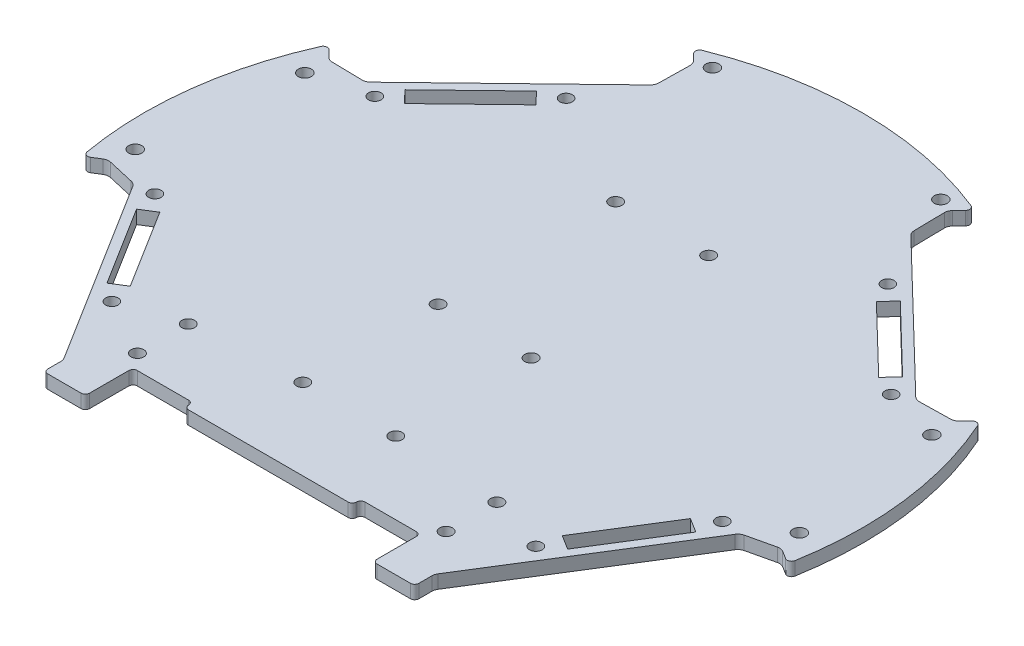
from build123d import *

# Parameters (mm, degrees)
BOSS_EXTRUDE4_DEPTH       = 1.5875
M3_CLEARANCE_HOLE3_D      = 3
M3_CLEARANCE_HOLE1_D      = 3.1
M3_CLEARANCE_HOLE4_D      = 2.95
M3_CLEARANCE_HOLE2_D      = 3.1
M3_CLEARANCE_HOLE5_D      = 3
BOSS_EXTRUDE6_DEPTH       = 3.175
FILLET1_R                 = 2
FILLET3_R                 = 1
ALIGNMENT_CUTOUT_FL_DEPTH = 121.250075508
ALIGNMENT_CUTOUT_FR_DEPTH = 121.250075508
ALIGNMENT_CUTOUT_RL_DEPTH = 121.250075508
ALIGNMENT_CUTOUT_RR_DEPTH = 121.250075508


with BuildPart() as part:
    # Sketch1 → Boss-Extrude4 (new, symmetric)
    with BuildSketch(Plane(origin=(0, 0, 0), x_dir=(1, 0, 0), z_dir=(0, 1, 0))):
        with BuildLine():
            Line((-62.799553621, 32.496136604), (-73.969425011, 32.691107434))
            Line((-73.969425011, 32.691107434), (-77.053684287, 35.88495141))
            ThreePointArc((-77.053684287, 35.88495141), (-84.36642289, 10.358894189), (-83.446216027, -16.178041625))
            Line((-83.446216027, -16.178041625), (-79.680911643, -13.825218315))
            Line((-79.680911643, -13.825218315), (-69.484649137, -16.179210996))
            Line((-69.484649137, -16.179210996), (-43.894490772, -57.132025032))
            Line((-43.894490772, -57.132025032), (-43.894490772, -64.826600275))
            Line((-43.894490772, -64.826600275), (-43.094490772, -64.826600275))
            Line((-43.094490772, -64.826600275), (-34, -64.826600275))
            Line((-34, -64.826600275), (-34, -55.55))
            Line((-34, -55.55), (-34, -53.55))
            Line((-34, -53.55), (-20, -53.55))
            Line((-20, -53.55), (-19.718918331, -55.55))
            Line((-19.718918331, -55.55), (19.718918331, -55.55))
            Line((19.718918331, -55.55), (20, -53.55))
            Line((20, -53.55), (34, -53.55))
            Line((34, -53.55), (34, -55.55))
            Line((34, -55.55), (34, -64.826600275))
            Line((34, -64.826600275), (43.094490772, -64.826600275))
            Line((43.094490772, -64.826600275), (43.894490772, -64.826600275))
            Line((43.894490772, -64.826600275), (43.894490772, -57.132025032))
            Line((43.894490772, -57.132025032), (69.484649137, -16.179210996))
            Line((69.484649137, -16.179210996), (79.680911643, -13.825218315))
            Line((79.680911643, -13.825218315), (83.446216027, -16.178041625))
            ThreePointArc((83.446216027, -16.178041625), (84.610662337, -8.126242604), (85, 0))
            ThreePointArc((85, 0), (82.98964744, 18.377116688), (77.053684287, 35.88495141))
            Line((77.053684287, 35.88495141), (73.969425011, 32.691107434))
            Line((73.969425011, 32.691107434), (62.799553621, 32.496136604))
            Line((62.799553621, 32.496136604), (30.284668021, 63.895396642))
            Line((30.284668021, 63.895396642), (30.089697191, 75.065268032))
            Line((30.089697191, 75.065268032), (33.173956467, 78.259112008))
            ThreePointArc((33.173956467, 78.259112008), (0, 85), (-33.173956467, 78.259112008))
            Line((-33.173956467, 78.259112008), (-30.089697191, 75.065268032))
            Line((-30.089697191, 75.065268032), (-30.284668021, 63.895396642))
            Line((-30.284668021, 63.895396642), (-62.799553621, 32.496136604))
        make_face()
    extrude(amount=BOSS_EXTRUDE4_DEPTH, both=True)

    # M3 Clearance Hole3 (through all)
    with Locations(Plane(origin=(0, -1.5875, 0), x_dir=(-1, 0, 0), z_dir=(0, -1, 0))):
        with Locations((36.5, -50), (36.5, -38), (-36.5, -50), (-36.5, -38)):
            Hole(M3_CLEARANCE_HOLE3_D / 2)

    # M3 Clearance Hole1 (through all)
    with Locations(Plane(origin=(0, 1.5875, 0), x_dir=(1, 0, 0), z_dir=(0, 1, 0))):
        with Locations((-78.542321426, -8.49139241), (78.542321426, -8.49139241), (74.155025063, 27.240269049), (-74.155025063, 27.240269049)):
            Hole(M3_CLEARANCE_HOLE1_D / 2)

    # M3 Clearance Hole4 (through all)
    with Locations(Plane(origin=(0, -1.5875, 0), x_dir=(-1, 0, 0), z_dir=(0, -1, 0))):
        with Locations((-67.099301622, -15.278865202), (-50.141885166, -42.416404279), (-61.062544382, 30.698137949), (-38.043670771, 52.927205804), (50.141885166, -42.416404279), (67.099301622, -15.278865202), (38.043670771, 52.927205804), (61.062544382, 30.698137949)):
            Hole(M3_CLEARANCE_HOLE4_D / 2)

    # M3 Clearance Hole2 (through all)
    with Locations(Plane(origin=(0, 1.5875, 0), x_dir=(1, 0, 0), z_dir=(0, 1, 0))):
        with Locations((27, 76.497766718), (-27, 76.497766718)):
            Hole(M3_CLEARANCE_HOLE2_D / 2)

    # M3 Clearance Hole5 (through all)
    with Locations(Plane(origin=(0, 1.5875, 0), x_dir=(1, 0, 0), z_dir=(0, 1, 0))):
        with Locations((-11, -4.4), (11, -4.4), (11, -36.4), (-11, -36.4), (-11, 37.6), (11, 37.6)):
            Hole(M3_CLEARANCE_HOLE5_D / 2)

    # Sketch22 → Boss-Extrude6 (add)
    with BuildSketch(Plane(origin=(0, 1.5875, 0), x_dir=(1, 0, 0), z_dir=(0, 1, 0))):
        Polygon((65.061950694, 32.535626892), (30.245177733, 66.157793715), (30.284668021, 63.895396642), (62.799553621, 32.496136604), align=None)
        Polygon((-30.284668021, 63.895396642), (-30.245177733, 66.157793715), (-65.061950694, 32.535626892), (-62.799553621, 32.496136604), align=None)
        Polygon((43.894490772, -60.151352895), (71.689396914, -15.670204865), (69.484649137, -16.179210996), (43.894490772, -57.132025032), align=None)
        Polygon((-69.484649137, -16.179210996), (-71.689396914, -15.670204865), (-43.894490772, -60.151352895), (-43.894490772, -57.132025032), align=None)
    extrude(amount=-BOSS_EXTRUDE6_DEPTH)

    # Fillet1
    fillet1_edges = [part.edges().sort_by_distance(p)[0] for p in [
        (-30.245177733, -0.79375, -66.157793715),
        (-65.061950694, -0.79375, -32.535626892),
        (-71.689396914, 0.79375, 15.670204865),
        (-43.894490772, 0.79375, 60.151352895),
        (43.894490772, -0.79375, 60.151352895),
        (71.689396914, -0.79375, 15.670204865),
        (65.061950694, -0.79375, -32.535626892),
        (30.245177733, 0.79375, -66.157793715),
        (30.089697191, -0.79375, -75.065268032),
        (73.969425011, -0.79375, -32.691107434),
        (79.680911643, -0.79375, 13.825218315),
        (-79.680911643, -0.79375, 13.825218315),
        (-73.969425011, -0.79375, -32.691107434),
        (-30.089697191, -0.79375, -75.065268032),
    ]]
    fillet(fillet1_edges, radius=FILLET1_R)

    # Fillet3
    fillet3_edges = [part.edges().sort_by_distance(p)[0] for p in [
        (33.173956467, -0.79375, -78.259112008),
        (77.053684287, 0.79375, -35.88495141),
        (83.446216027, -0.79375, 16.178041625),
        (43.894490772, -0.79375, 64.826600275),
        (34, 0.79375, 64.826600275),
        (34, -0.79375, 53.55),
        (20, -0.79375, 53.55),
        (19.718918331, 0.79375, 55.55),
        (-19.718918331, 0.79375, 55.55),
        (-20, -0.79375, 53.55),
        (-34, -0.79375, 53.55),
        (-34, 0.79375, 64.826600275),
        (-43.894490772, -0.79375, 64.826600275),
        (-83.446216027, -0.79375, 16.178041625),
        (-77.053684287, -0.79375, -35.88495141),
        (-33.173956467, -0.79375, -78.259112008),
    ]]
    fillet(fillet3_edges, radius=FILLET3_R)

    # Sketch27 → Alignment Cutout - FL (cut, through all)
    with BuildSketch(Plane(origin=(0, 1.5875, 0), x_dir=(1, 0, 0), z_dir=(0, 1, 0))):
        Polygon((51.095385295, -37.11632527), (54.48757768, -39.236002327), (66.145801493, -20.578944211), (62.753609108, -18.459267154), align=None)
    extrude(amount=-ALIGNMENT_CUTOUT_FL_DEPTH, mode=Mode.SUBTRACT)

    # Sketch28 → Alignment Cutout - FR (cut, through all)
    with BuildSketch(Plane(origin=(0, 1.5875, 0), x_dir=(1, 0, 0), z_dir=(0, 1, 0))):
        Polygon((-54.48757768, -39.236002327), (-51.095385295, -37.11632527), (-62.753609108, -18.459267154), (-66.145801493, -20.578944211), align=None)
    extrude(amount=-ALIGNMENT_CUTOUT_FR_DEPTH, mode=Mode.SUBTRACT)

    # Sketch29 → Alignment Cutout - RL (cut, through all)
    with BuildSketch(Plane(origin=(0, 1.5875, 0), x_dir=(1, 0, 0), z_dir=(0, 1, 0))):
        Polygon((40.251053032, 48.015234351), (43.029686514, 50.892593553), (58.855162121, 35.610109402), (56.07652864, 32.732750201), align=None)
    extrude(amount=-ALIGNMENT_CUTOUT_RL_DEPTH, mode=Mode.SUBTRACT)

    # Sketch30 → Alignment Cutout - RR (cut, through all)
    with BuildSketch(Plane(origin=(0, 1.5875, 0), x_dir=(1, 0, 0), z_dir=(0, 1, 0))):
        Polygon((-56.07652864, 32.732750201), (-58.855162121, 35.610109402), (-43.029686514, 50.892593553), (-40.251053032, 48.015234351), align=None)
    extrude(amount=-ALIGNMENT_CUTOUT_RR_DEPTH, mode=Mode.SUBTRACT)


solid = part.part
